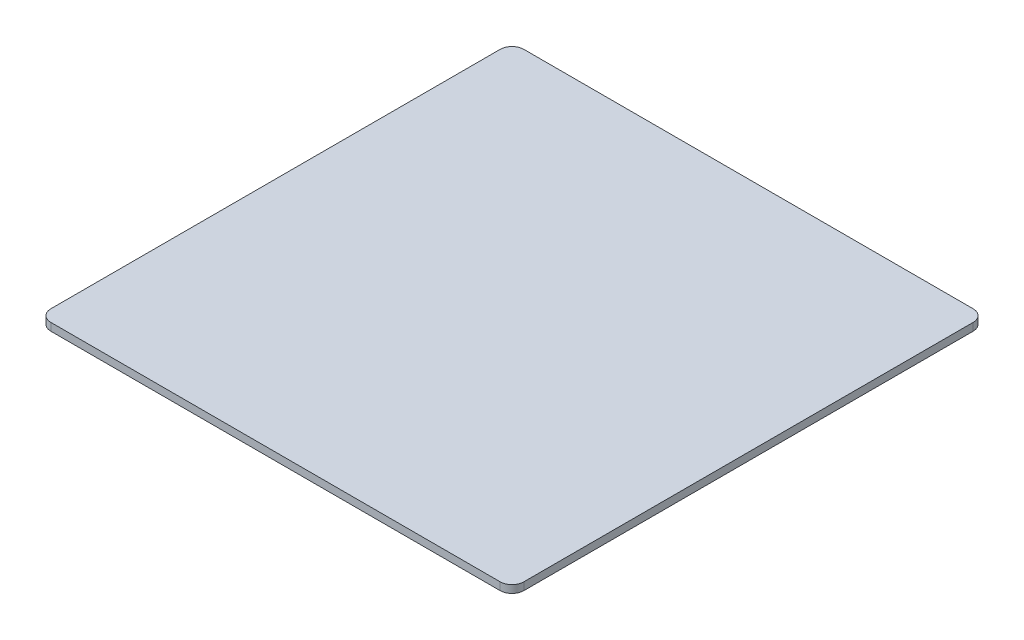
from build123d import *

# Parameters (mm, degrees)
SKETCH3_W           = 203.2
SKETCH3_H           = 203.2
BOSS_EXTRUDE1_DEPTH = 3.302
FILLET1_R           = 5.08
FILLET2_R           = 5.08
FILLET3_R           = 5.08
FILLET4_R           = 5.08


with BuildPart() as part:
    # Sketch3 → Boss-Extrude1 (new body)
    with BuildSketch(Plane(origin=(0, 0, 0), x_dir=(1, 0, 0), z_dir=(0, 1, 0))):
        with Locations((-101.6, 101.6)):
            Rectangle(SKETCH3_W, SKETCH3_H)
    extrude(amount=BOSS_EXTRUDE1_DEPTH)

    # Fillet1
    fillet1_edges = [part.edges().sort_by_distance(p)[0] for p in [
        (-203.2, 1.651, 0),
    ]]
    fillet(fillet1_edges, radius=FILLET1_R)

    # Fillet2
    fillet2_edges = [part.edges().sort_by_distance(p)[0] for p in [
        (0, 1.651, 0),
    ]]
    fillet(fillet2_edges, radius=FILLET2_R)

    # Fillet3
    fillet3_edges = [part.edges().sort_by_distance(p)[0] for p in [
        (0, 1.651, -203.2),
    ]]
    fillet(fillet3_edges, radius=FILLET3_R)

    # Fillet4
    fillet4_edges = [part.edges().sort_by_distance(p)[0] for p in [
        (-203.2, 1.651, -203.2),
    ]]
    fillet(fillet4_edges, radius=FILLET4_R)


solid = part.part
